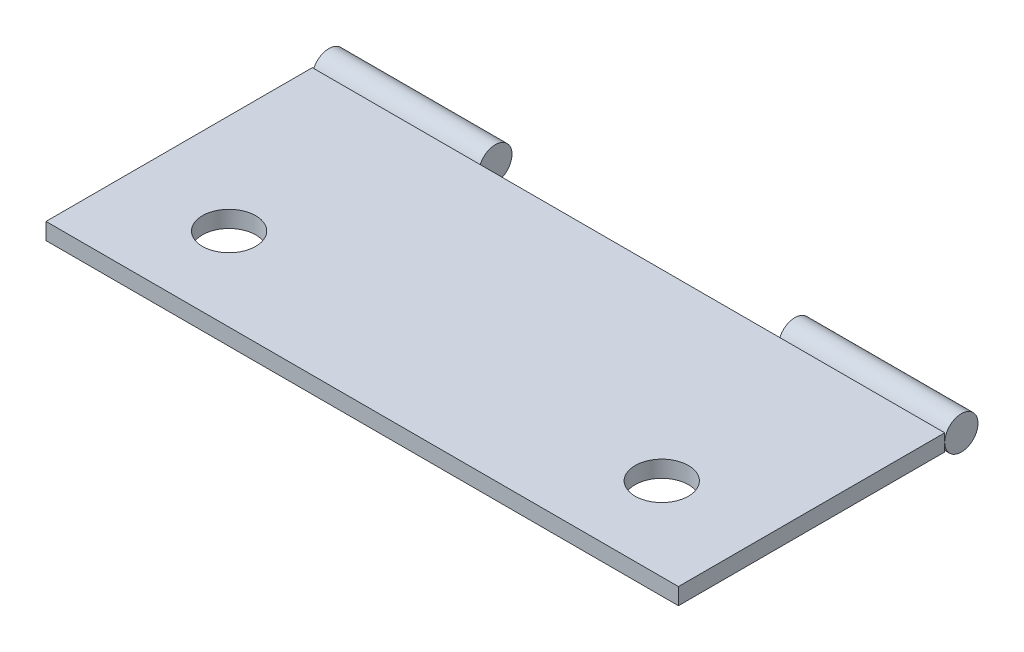
from build123d import *

# Parameters (mm, degrees)
SKETCH_1_W               = 38
SKETCH_1_H               = 29
EXTRUDE_1_DEPTH          = 1
CUT_EXTRUDE_1_REACH      = 25.922
SKETCH_2_R               = 1.6
SKETCH_2_R_2             = 1.38449668
SKETCH_3_W               = 38
SKETCH_3_H               = 13
CUT_EXTRUDE_2_DEPTH      = 8
SKETCH_5_R               = 1
EXTRUDE_2_DEPTH          = 38
CUT_EXTRUDE_3_DEPTH      = 24.948056448
CUT_EXTRUDE_3_DEPTH_BACK = 24.948056448
SKETCH_6_W               = 18
SKETCH_6_H               = 3.858849935


with BuildPart() as part:
    # 草图1 → 凸台-拉伸1 (new body)
    with BuildSketch(Plane(origin=(0, 0, 0), x_dir=(1, 0, 0), z_dir=(0, 1, 0))):
        Rectangle(SKETCH_1_W, SKETCH_1_H)
    extrude(amount=EXTRUDE_1_DEPTH)

    # 草图2 → 切除-拉伸1 (cut, up to next)
    with BuildSketch(Plane(origin=(0, 1, 0), x_dir=(1, 0, 0), z_dir=(0, 1, 0)), mode=Mode.PRIVATE) as cut_extrude_1_sk1:
        with Locations(Location((13, -9.5, 0), (0, 0, 270))):
            Circle(SKETCH_2_R)
    cut_extrude_1_tool1 = extrude(cut_extrude_1_sk1.sketch, amount=-CUT_EXTRUDE_1_REACH, mode=Mode.PRIVATE) & part.part
    # 草图2 → 切除-拉伸1 (cut, up to next)
    with BuildSketch(Plane(origin=(0, 1, 0), x_dir=(1, 0, 0), z_dir=(0, 1, 0)), mode=Mode.PRIVATE) as cut_extrude_1_sk2:
        with Locations(Location((13, 9.5, 0), (0, 0, 270))):
            Circle(SKETCH_2_R_2)
    cut_extrude_1_tool2 = extrude(cut_extrude_1_sk2.sketch, amount=-CUT_EXTRUDE_1_REACH, mode=Mode.PRIVATE) & part.part
    # 草图2 → 切除-拉伸1 (cut, up to next)
    with BuildSketch(Plane(origin=(0, 1, 0), x_dir=(1, 0, 0), z_dir=(0, 1, 0)), mode=Mode.PRIVATE) as cut_extrude_1_sk3:
        with Locations(Location((-13, 9.5, 0), (0, 0, 270))):
            Circle(SKETCH_2_R_2)
    cut_extrude_1_tool3 = extrude(cut_extrude_1_sk3.sketch, amount=-CUT_EXTRUDE_1_REACH, mode=Mode.PRIVATE) & part.part
    # 草图2 → 切除-拉伸1 (cut, up to next)
    with BuildSketch(Plane(origin=(0, 1, 0), x_dir=(1, 0, 0), z_dir=(0, 1, 0)), mode=Mode.PRIVATE) as cut_extrude_1_sk4:
        with Locations(Location((-13, -9.5, 0), (0, 0, 270))):
            Circle(SKETCH_2_R)
    cut_extrude_1_tool4 = extrude(cut_extrude_1_sk4.sketch, amount=-CUT_EXTRUDE_1_REACH, mode=Mode.PRIVATE) & part.part
    add(cut_extrude_1_tool1.solids().sort_by_distance((13, 1, 9.5))[0], mode=Mode.SUBTRACT)
    add(cut_extrude_1_tool2.solids().sort_by_distance((13, 1, -9.5))[0], mode=Mode.SUBTRACT)
    add(cut_extrude_1_tool3.solids().sort_by_distance((-13, 1, -9.5))[0], mode=Mode.SUBTRACT)
    add(cut_extrude_1_tool4.solids().sort_by_distance((-13, 1, 9.5))[0], mode=Mode.SUBTRACT)

    # 草图3 → 切除-拉伸2 (cut)
    with BuildSketch(Plane(origin=(0, 1, 0), x_dir=(1, 0, 0), z_dir=(0, 1, 0))):
        with Locations((0, 8)):
            Rectangle(SKETCH_3_W, SKETCH_3_H)
    extrude(amount=-CUT_EXTRUDE_2_DEPTH, mode=Mode.SUBTRACT)


with BuildPart() as body_2:
    # 草图5 → 凸台-拉伸2 (new body)
    with BuildSketch(Plane(origin=(19, 0, 0), x_dir=(0, 0, -1), z_dir=(1, 0, 0))):
        with Locations((2.5, 0.496867392)):
            Circle(SKETCH_5_R)
    extrude(amount=-EXTRUDE_2_DEPTH)

    # 草图6 → 切除-拉伸3 (cut, two sides: drawn at the far end of the back side and taken through both)
    with BuildSketch(Plane(origin=(0, 1, 0), x_dir=(1, 0, 0), z_dir=(0, 1, 0)).offset(-CUT_EXTRUDE_3_DEPTH_BACK)):
        with Locations((0, 3.429424968)):
            Rectangle(SKETCH_6_W, SKETCH_6_H)
    extrude(amount=CUT_EXTRUDE_3_DEPTH + CUT_EXTRUDE_3_DEPTH_BACK, mode=Mode.SUBTRACT)


with BuildPart() as cut_extrude_3_piece_1:
    # of the separate pieces the step leaves, piece 1, a body of its own (cut_extrude_3_pieces)
    add(body_2.part.solids().sort_by_distance((-9, 0.496867392, -3.5))[0])


with BuildPart() as cut_extrude_3_piece_2:
    # of the separate pieces the step leaves, piece 2, a body of its own (cut_extrude_3_pieces)
    add(body_2.part.solids().sort_by_distance((19, 0.496867392, -3.5))[0])


solid = Compound([part.part, cut_extrude_3_piece_1.part, cut_extrude_3_piece_2.part])
